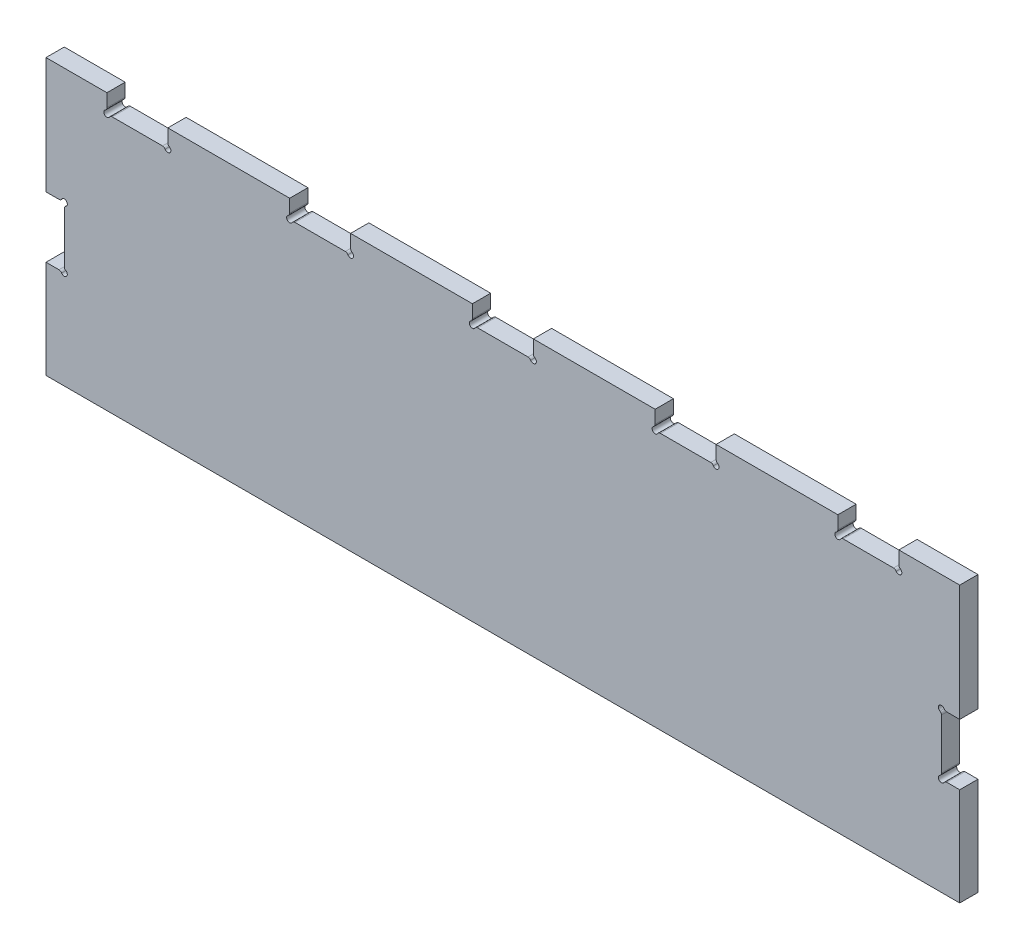
from build123d import *

# Parameters (mm, degrees)
BOSS_EXTRUDE1_DEPTH     = 1.5
CUT_EXTRUDE1_DEPTH      = 88.618719461
CUT_EXTRUDE1_DEPTH_BACK = 88.618719461
SKETCH2_R               = 0.5
FILLET1_R               = 0.5


with BuildPart() as part:
    # Sketch1 → Boss-Extrude1 (new, symmetric)
    with BuildSketch(Plane.XY):
        Polygon((65, -3), (65, 0), (75, 0), (75, -19.1), (72, -19.1), (72, -29.1), (75, -29.1), (75, -45.2), (-75, -45.2), (-75, -29.1), (-72, -29.1), (-72, -19.1), (-75, -19.1), (-75, 0), (-65, 0), (-65, -3), (-55, -3), (-55, 0), (-35, 0), (-35, -3), (-25, -3), (-25, 0), (-5, 0), (-5, -3), (5, -3), (5, 0), (25, 0), (25, -3), (35, -3), (35, 0), (55, 0), (55, -3), align=None)
    extrude(amount=BOSS_EXTRUDE1_DEPTH, both=True)

    # Sketch2 → Cut-Extrude1 (cut, two sides: drawn at the far end of the back side and taken through both)
    with BuildSketch(Plane.XY.offset(1.5).offset(-CUT_EXTRUDE1_DEPTH_BACK)):
        with Locations((-72, -29.1)):
            Circle(SKETCH2_R)
        with Locations((-72, -19.1)):
            Circle(SKETCH2_R)
        with Locations((-65, -3)):
            Circle(SKETCH2_R)
        with Locations((-55, -3)):
            Circle(SKETCH2_R)
        with Locations((-35, -3)):
            Circle(SKETCH2_R)
        with Locations((-25, -3)):
            Circle(SKETCH2_R)
        with Locations((-5, -3)):
            Circle(SKETCH2_R)
        with Locations((5, -3)):
            Circle(SKETCH2_R)
        with Locations((25, -3)):
            Circle(SKETCH2_R)
        with Locations((35, -3)):
            Circle(SKETCH2_R)
        with Locations((55, -3)):
            Circle(SKETCH2_R)
        with Locations((65, -3)):
            Circle(SKETCH2_R)
        with Locations((72, -19.1)):
            Circle(SKETCH2_R)
        with Locations((72, -29.1)):
            Circle(SKETCH2_R)
    extrude(amount=CUT_EXTRUDE1_DEPTH + CUT_EXTRUDE1_DEPTH_BACK, mode=Mode.SUBTRACT)

    # Fillet1
    fillet1_edges = [part.edges().sort_by_distance(p)[0] for p in [
        (72.5, -29.1, 0),
        (72, -28.6, 0),
        (72, -19.6, 0),
        (72.5, -19.1, 0),
        (65, -2.5, 0),
        (64.5, -3, 0),
        (55.5, -3, 0),
        (55, -2.5, 0),
        (35, -2.5, 0),
        (34.5, -3, 0),
        (25.5, -3, 0),
        (25, -2.5, 0),
        (5, -2.5, 0),
        (4.5, -3, 0),
        (-4.5, -3, 0),
        (-5, -2.5, 0),
        (-25, -2.5, 0),
        (-25.5, -3, 0),
        (-34.5, -3, 0),
        (-35, -2.5, 0),
        (-55, -2.5, 0),
        (-55.5, -3, 0),
        (-64.5, -3, 0),
        (-65, -2.5, 0),
        (-72.5, -19.1, 0),
        (-72, -19.6, 0),
        (-72, -28.6, 0),
        (-72.5, -29.1, 0),
    ]]
    fillet(fillet1_edges, radius=FILLET1_R)


solid = part.part
